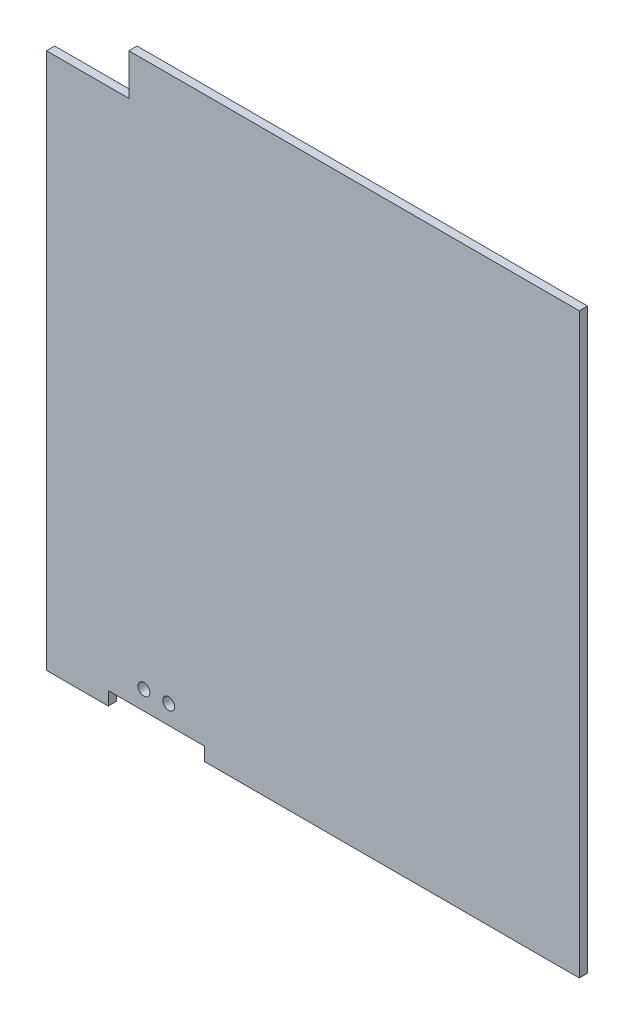
from build123d import *

# Parameters (mm, degrees)
SKETCH_1_W               = 180
SKETCH_1_H               = 195
EXTRUDE_1_DEPTH          = 3
CUT_EXTRUDE_1_DEPTH      = 133.722454769
CUT_EXTRUDE_1_DEPTH_BACK = 133.722454769
SKETCH_2_R               = 2.15
SKETCH_3_W               = 10
SKETCH_3_H               = 195
EXTRUDE_2_DEPTH          = 3
SKETCH_4_W               = 116
SKETCH_4_H               = 22
EXTRUDE_3_DEPTH          = 3
CUT_EXTRUDE_2_DEPTH      = 156.850088226
CUT_EXTRUDE_2_DEPTH_BACK = 156.850088226
SKETCH_5_W               = 116
SKETCH_5_H               = 7
CUT_EXTRUDE_3_DEPTH      = 151.549825639
CUT_EXTRUDE_3_DEPTH_BACK = 151.549825639
CUT_EXTRUDE_4_DEPTH      = 150.06122903
CUT_EXTRUDE_4_DEPTH_BACK = 150.06122903
SKETCH_7_W               = 188
SKETCH_7_H               = 38.626728851
EXTRUDE_4_DEPTH          = 3
CUT_EXTRUDE_5_DEPTH      = 159.937880947
CUT_EXTRUDE_5_DEPTH_BACK = 159.937880947
SKETCH_9_W               = 6
SKETCH_9_H               = 195.373271149
SKETCH_11_W              = 164
SKETCH_11_H              = 15
EXTRUDE_5_DEPTH          = 3


with BuildPart() as part:
    # 草图1 → 凸台-拉伸1 (new body)
    with BuildSketch(Plane.XY):
        Rectangle(SKETCH_1_W, SKETCH_1_H)
    extrude(amount=EXTRUDE_1_DEPTH)

    # 草图2 → 切除-拉伸1 (cut, two sides: drawn at the far end of the back side and taken through both)
    with BuildSketch(Plane.XY.offset(3).offset(-CUT_EXTRUDE_1_DEPTH_BACK)):
        with Locations((-58.5, -60.1)):
            Circle(SKETCH_2_R)
        with Locations((-49.5, -60.1)):
            Circle(SKETCH_2_R)
        Polygon((-71.5, -67), (-67.7, -67), (-40.3, -67), (-36.5, -67), (-36.5, -72.5), (-26, -72.5), (-26, -97.5), (-82, -97.5), (-82, -72.5), (-71.5, -72.5), align=None)
    extrude(amount=CUT_EXTRUDE_1_DEPTH + CUT_EXTRUDE_1_DEPTH_BACK, mode=Mode.SUBTRACT)

    # 草图3 → 凸台-拉伸2 (add)
    with BuildSketch(Plane.XY.offset(3)):
        with Locations((-95, 0)):
            Rectangle(SKETCH_3_W, SKETCH_3_H)
    extrude(amount=-EXTRUDE_2_DEPTH)

    # 草图4 → 凸台-拉伸3 (add)
    with BuildSketch(Plane(origin=(0, 0, 0), x_dir=(-1, 0, 0), z_dir=(0, 0, -1))):
        with Locations((-32, -108.5)):
            Rectangle(SKETCH_4_W, SKETCH_4_H)
    extrude(amount=-EXTRUDE_3_DEPTH)

    # 草图5 → 切除-拉伸2 (cut, two sides: drawn at the far end of the back side and taken through both)
    with BuildSketch(Plane(origin=(0, 0, 0), x_dir=(-1, 0, 0), z_dir=(0, 0, -1)).offset(-CUT_EXTRUDE_2_DEPTH_BACK)):
        with Locations((-32, -116)):
            Rectangle(SKETCH_5_W, SKETCH_5_H)
    extrude(amount=CUT_EXTRUDE_2_DEPTH + CUT_EXTRUDE_2_DEPTH_BACK, mode=Mode.SUBTRACT)

    # 草图6 → 切除-拉伸3 (cut, two sides: drawn at the far end of the back side and taken through both)
    with BuildSketch(Plane(origin=(0, 0, 0), x_dir=(-1, 0, 0), z_dir=(0, 0, -1)).offset(-CUT_EXTRUDE_3_DEPTH_BACK)):
        Polygon((100, -97.5), (100, -95.5), (84, -95.5), (84, -72.5), (82, -72.5), (82, -97.5), align=None)
        Polygon((24, -72.5), (24, -110.5), (-88, -110.5), (-88, 95.5), (100, 95.5), (100, 97.5), (-90, 97.5), (-90, -112.5), (26, -112.5), (26, -72.5), align=None)
    extrude(amount=CUT_EXTRUDE_3_DEPTH + CUT_EXTRUDE_3_DEPTH_BACK, mode=Mode.SUBTRACT)

    # 草图7 → 切除-拉伸4 (cut, two sides: drawn at the far end of the back side and taken through both)
    with BuildSketch(Plane(origin=(0, 0, 0), x_dir=(-1, 0, 0), z_dir=(0, 0, -1)).offset(-CUT_EXTRUDE_4_DEPTH_BACK)):
        with Locations((6, -91.186635575)):
            Rectangle(SKETCH_7_W, SKETCH_7_H)
    extrude(amount=CUT_EXTRUDE_4_DEPTH + CUT_EXTRUDE_4_DEPTH_BACK, mode=Mode.SUBTRACT)

    # 草图8 → 凸台-拉伸4 (add)
    with BuildSketch(Plane(origin=(0, 0, 0), x_dir=(-1, 0, 0), z_dir=(0, 0, -1))):
        Polygon((-88, 95.5), (100, 95.5), (100, 123.5), (-80, 123.5), (-100, 123.5), (-100, -71.873271149), (-88, -71.873271149), align=None)
    extrude(amount=-EXTRUDE_4_DEPTH)

    # 草图9 → 切除-拉伸5 (cut, two sides: drawn at the far end of the back side and taken through both)
    with BuildSketch(Plane(origin=(0, 0, 0), x_dir=(-1, 0, 0), z_dir=(0, 0, -1)).offset(-CUT_EXTRUDE_5_DEPTH_BACK)):
        with Locations((97, 25.813364426)):
            Rectangle(SKETCH_9_W, SKETCH_9_H)
    extrude(amount=CUT_EXTRUDE_5_DEPTH + CUT_EXTRUDE_5_DEPTH_BACK, mode=Mode.SUBTRACT)

    # 草图11 → 凸台-拉伸5 (add)
    with BuildSketch(Plane(origin=(0, 0, 0), x_dir=(-1, 0, 0), z_dir=(0, 0, -1))):
        with Locations((-18, 131)):
            Rectangle(SKETCH_11_W, SKETCH_11_H)
    extrude(amount=-EXTRUDE_5_DEPTH)


solid = part.part
